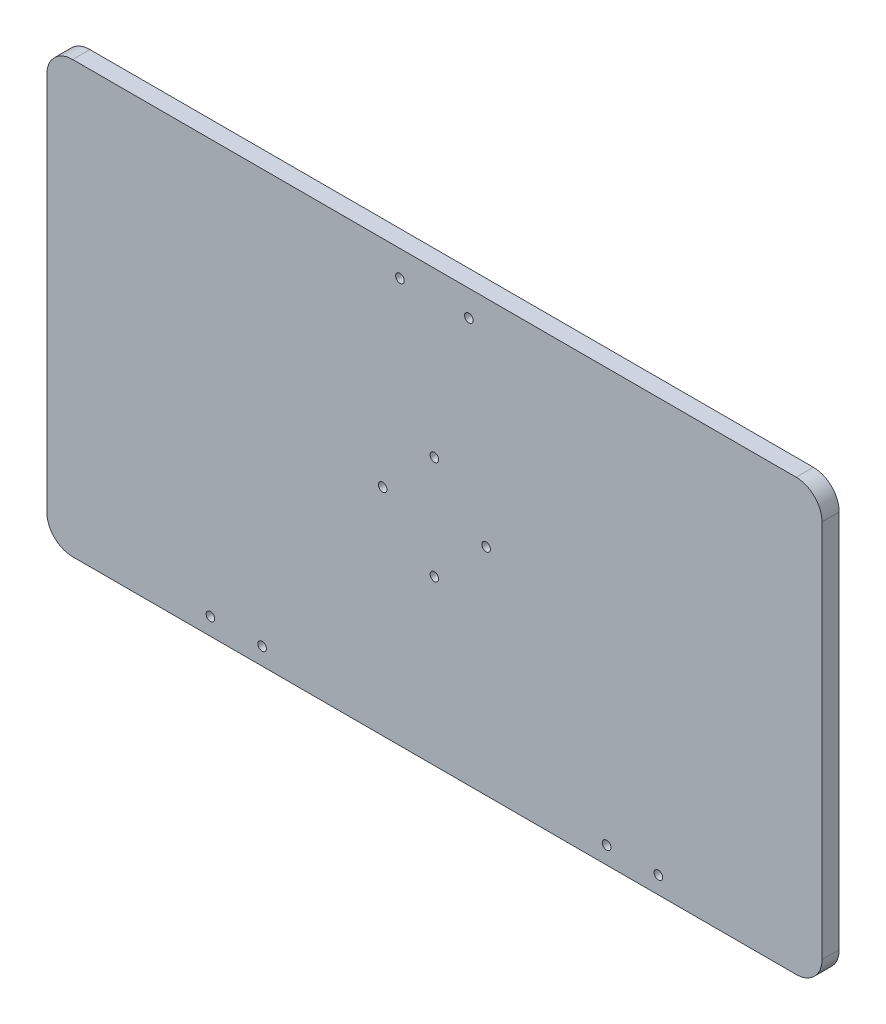
from build123d import *

# Parameters (mm, degrees)
CROQUIS1_R              = 2.5
SALIENTE_EXTRUIR1_DEPTH = 10


with BuildPart() as part:
    # Croquis1 → Saliente-Extruir1 (new body)
    with BuildSketch(Plane.XY):
        with BuildLine():
            Line((15, 0), (435, 0))
            ThreePointArc((435, 0), (445.606601718, 4.393398282), (450, 15))
            Line((450, 15), (450, 235))
            ThreePointArc((450, 235), (445.606601718, 245.606601718), (435, 250))
            Line((435, 250), (15, 250))
            ThreePointArc((15, 250), (4.393398282, 245.606601718), (0, 235))
            Line((0, 235), (0, 15))
            ThreePointArc((0, 15), (4.393398282, 4.393398282), (15, 0))
        make_face()
        with Locations((255, 125)):
            Circle(CROQUIS1_R, mode=Mode.SUBTRACT)
        with Locations((225, 95)):
            Circle(CROQUIS1_R, mode=Mode.SUBTRACT)
        with Locations((195, 125)):
            Circle(CROQUIS1_R, mode=Mode.SUBTRACT)
        with Locations((225, 155)):
            Circle(CROQUIS1_R, mode=Mode.SUBTRACT)
        with Locations((125, 10)):
            Circle(CROQUIS1_R, mode=Mode.SUBTRACT)
        with Locations((95, 10)):
            Circle(CROQUIS1_R, mode=Mode.SUBTRACT)
        with Locations(Location((355, 10, 0), (0, 0, 180))):
            Circle(CROQUIS1_R, mode=Mode.SUBTRACT)
        with Locations(Location((325, 10, 0), (0, 0, 180))):
            Circle(CROQUIS1_R, mode=Mode.SUBTRACT)
        with Locations((245, 235)):
            Circle(CROQUIS1_R, mode=Mode.SUBTRACT)
        with Locations((205, 235)):
            Circle(CROQUIS1_R, mode=Mode.SUBTRACT)
    extrude(amount=SALIENTE_EXTRUIR1_DEPTH)


solid = part.part
